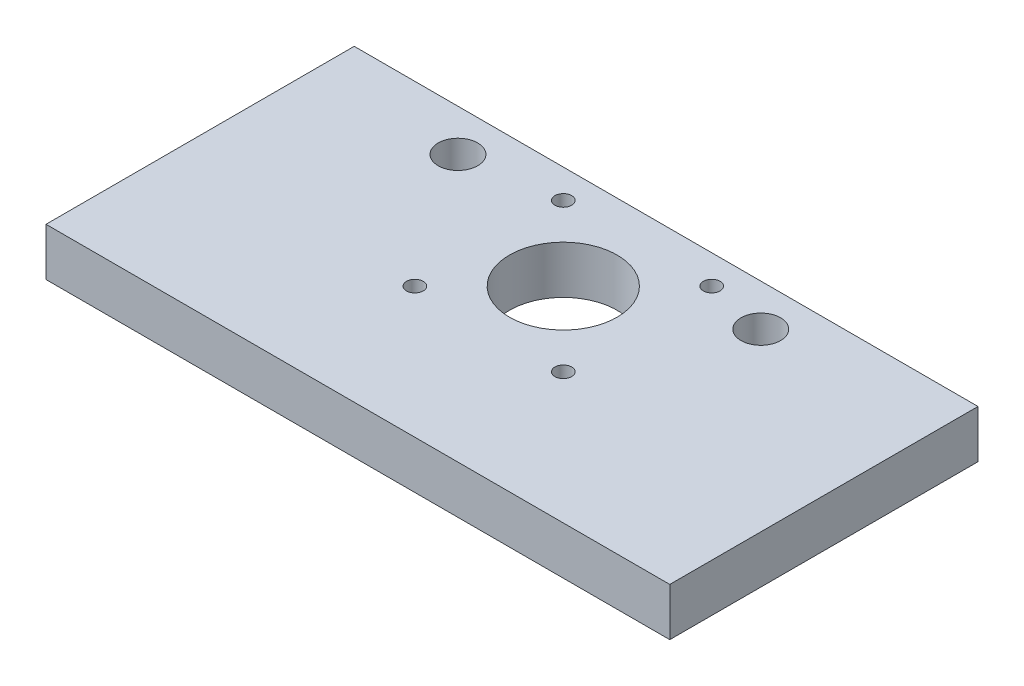
from build123d import *

# Parameters (mm, degrees)
SKETCH1_W           = 130.309019047
SKETCH1_H           = 64.389068899
SKETCH1_R           = 1.75
SKETCH1_R_2         = 11.25
SKETCH1_R_3         = 4.13181922
BOSS_EXTRUDE1_DEPTH = 10


with BuildPart() as part:
    # Sketch1 → Boss-Extrude1 (new body)
    with BuildSketch(Plane(origin=(0, 0, 0), x_dir=(1, 0, 0), z_dir=(0, 1, 0))):
        with Locations((65.154509524, 32.19453445)):
            Rectangle(SKETCH1_W, SKETCH1_H)
        with Locations(Location((49.718464568, 58.345012134, 0), (0, 0, 270))):
            Circle(SKETCH1_R, mode=Mode.SUBTRACT)
        with Locations(Location((80.718464568, 58.345012134, 0), (0, 0, 270))):
            Circle(SKETCH1_R, mode=Mode.SUBTRACT)
        with Locations(Location((49.718464568, 27.345012134, 0), (0, 0, 270))):
            Circle(SKETCH1_R, mode=Mode.SUBTRACT)
        with Locations(Location((80.718464568, 27.345012134, 0), (0, 0, 270))):
            Circle(SKETCH1_R, mode=Mode.SUBTRACT)
        with Locations(Location((65.218464568, 42.845012134, 0), (0, 0, 270))):
            Circle(SKETCH1_R_2, mode=Mode.SUBTRACT)
        with Locations(Location((30.381266396, 55.679769356, 0), (0, 0, 270))):
            Circle(SKETCH1_R_3, mode=Mode.SUBTRACT)
        with Locations(Location((93.638284129, 55.679769356, 0), (0, 0, 270))):
            Circle(SKETCH1_R_3, mode=Mode.SUBTRACT)
    extrude(amount=BOSS_EXTRUDE1_DEPTH)


solid = part.part
